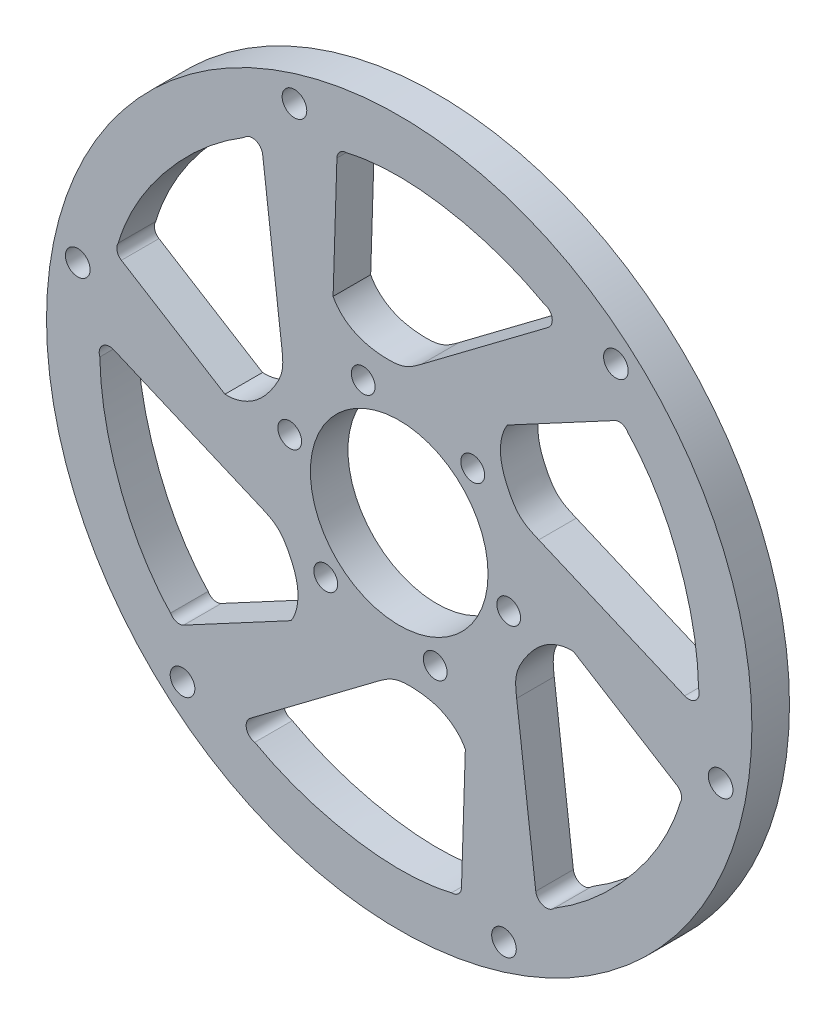
from build123d import *

# Parameters (mm, degrees)
SCHIZZO1_R                   = 37.92
SCHIZZO1_R_2                 = 1.325
SCHIZZO1_R_3                 = 9.55
SCHIZZO1_R_4                 = 1.28
ESTRUSIONE_ESTRUSIONE1_DEPTH = 4.04


with BuildPart() as part:
    # Schizzo1 → Estrusione-Estrusione1 (new body)
    with BuildSketch(Plane.XY):
        with Locations((39.644562935, 40.222708022)):
            Circle(SCHIZZO1_R)
        with Locations((28.381746106, 73.624975266)):
            Circle(SCHIZZO1_R_2, mode=Mode.SUBTRACT)
        with Locations((39.644562935, 40.222708022)):
            Circle(SCHIZZO1_R_3, mode=Mode.SUBTRACT)
        with Locations((35.774368233, 51.581475251)):
            Circle(SCHIZZO1_R_4, mode=Mode.SUBTRACT)
        with Locations((47.546446561, 49.253778566)):
            Circle(SCHIZZO1_R_4, mode=Mode.SUBTRACT)
        with Locations((62.940366498, 66.677727137)):
            Circle(SCHIZZO1_R_2, mode=Mode.SUBTRACT)
        with Locations((51.416641262, 37.895011337)):
            Circle(SCHIZZO1_R_4, mode=Mode.SUBTRACT)
        with Locations((74.203183328, 33.275459892)):
            Circle(SCHIZZO1_R_2, mode=Mode.SUBTRACT)
        with Locations((43.514757637, 28.863940793)):
            Circle(SCHIZZO1_R_4, mode=Mode.SUBTRACT)
        with Locations((50.907379765, 6.820440778)):
            Circle(SCHIZZO1_R_2, mode=Mode.SUBTRACT)
        with Locations((31.74267931, 31.191637478)):
            Circle(SCHIZZO1_R_4, mode=Mode.SUBTRACT)
        with Locations((16.348759372, 13.767688907)):
            Circle(SCHIZZO1_R_2, mode=Mode.SUBTRACT)
        with Locations((27.872484608, 42.550404707)):
            Circle(SCHIZZO1_R_4, mode=Mode.SUBTRACT)
        with Locations((5.085942543, 47.169956152)):
            Circle(SCHIZZO1_R_2, mode=Mode.SUBTRACT)
        with BuildLine():
            Line((32.537324842, 57.752341263), (32.947782143, 70.845929152))
            ThreePointArc((32.947782143, 70.845929152), (33.276613104, 71.574360929), (34.024210756, 71.856921375))
            add(Edge.make_bspline(
                [(34.024210756, 71.856921375), (37.813103061, 72.754463636), (45.237238781, 72.465064372), (52.177131888, 70.085413797), (55.180541117, 68.422554037)],
                knots=[0, 0, 0, 0, 0.531113686, 1, 1, 1, 1], degree=3))
            ThreePointArc((55.180541117, 68.422554037), (56.070695624, 67.573353666), (55.651210487, 66.416829331))
            Line((55.651210487, 66.416829331), (42.018531755, 56.173261728))
            add(Edge.make_bspline(
                [(32.537324842, 57.752341263), (33.085767208, 56.679660611), (34.829216379, 55.289156312), (37.666961886, 54.791954013), (40.192033726, 54.822389026), (41.396684563, 55.706006988), (42.018531755, 56.173261728)],
                knots=[0, 0, 0, 0, 0.332930463, 0.577052926, 0.800008074, 1, 1, 1, 1], degree=3))
        make_face(mode=Mode.SUBTRACT)
        with BuildLine():
            Line((54.645132059, 46.142067569), (70.332661194, 39.457605267))
            ThreePointArc((70.332661194, 39.457605267), (71.543983217, 39.67258265), (71.834335058, 40.868079251))
            add(Edge.make_bspline(
                [(64.230419238, 60.907182464), (66.902159789, 58.074676605), (70.363600535, 51.500486839), (71.772709238, 44.300537822), (71.834335058, 40.868079251)],
                knots=[0, 0, 0, 0, 0.531113686, 1, 1, 1, 1], degree=3))
            ThreePointArc((64.230419238, 60.907182464), (63.611915888, 61.413340799), (62.816659984, 61.333900877))
            Line((62.816659984, 61.333900877), (51.272051595, 55.142573382))
            add(Edge.make_bspline(
                [(51.272051595, 55.142573382), (50.617304082, 54.131268034), (50.284816621, 51.926144612), (51.273099553, 49.219983765), (52.561992967, 47.048424911), (53.929553988, 46.446975665), (54.645132059, 46.142067569)],
                knots=[0, 0, 0, 0, 0.332930463, 0.577052926, 0.800008074, 1, 1, 1, 1], degree=3))
        make_face(mode=Mode.SUBTRACT)
        with BuildLine():
            Line((52.271163239, 30.191513863), (54.326013642, 13.263483958))
            ThreePointArc((54.326013642, 13.263483958), (55.117850528, 12.321937006), (56.298356876, 12.668233236))
            add(Edge.make_bspline(
                [(69.850771418, 29.272969111), (68.733619663, 25.542920992), (64.770924689, 19.258130489), (59.240140286, 14.437832047), (56.298356876, 12.668233236)],
                knots=[0, 0, 0, 0, 0.531113686, 1, 1, 1, 1], degree=3))
            ThreePointArc((69.850771418, 29.272969111), (69.979865719, 30.061687892), (69.513440776, 30.710679746))
            Line((69.513440776, 30.710679746), (58.379289688, 37.61294014))
            add(Edge.make_bspline(
                [(58.379289688, 37.61294014), (57.176099809, 37.674315445), (55.100163177, 36.859696322), (53.250700602, 34.650737773), (52.014522176, 32.448743907), (52.177432361, 30.963676699), (52.271163239, 30.191513863)],
                knots=[0, 0, 0, 0, 0.332930463, 0.577052926, 0.800008074, 1, 1, 1, 1], degree=3))
        make_face(mode=Mode.SUBTRACT)
        with BuildLine():
            Line((37.270594115, 24.272154316), (23.637915383, 14.028586713))
            ThreePointArc((23.637915383, 14.028586713), (23.218430247, 12.872062378), (24.108584753, 12.022862007))
            add(Edge.make_bspline(
                [(45.264915115, 8.588494669), (41.476022809, 7.690952408), (34.051887089, 7.980351672), (27.111993983, 10.360002247), (24.108584753, 12.022862007)],
                knots=[0, 0, 0, 0, 0.531113686, 1, 1, 1, 1], degree=3))
            ThreePointArc((45.264915115, 8.588494669), (46.012512766, 8.871055115), (46.341343727, 9.599486892))
            Line((46.341343727, 9.599486892), (46.751801028, 22.693074781))
            add(Edge.make_bspline(
                [(46.751801028, 22.693074781), (46.203358662, 23.765755433), (44.459909491, 25.156259732), (41.622163984, 25.653462031), (39.097092144, 25.623027018), (37.892441308, 24.739409056), (37.270594115, 24.272154316)],
                knots=[0, 0, 0, 0, 0.332930463, 0.577052926, 0.800008074, 1, 1, 1, 1], degree=3))
        make_face(mode=Mode.SUBTRACT)
        with BuildLine():
            Line((24.643993811, 34.303348475), (8.956464676, 40.987810777))
            ThreePointArc((8.956464676, 40.987810777), (7.745142654, 40.772833394), (7.454790812, 39.577336793))
            add(Edge.make_bspline(
                [(15.058706632, 19.53823358), (12.386966081, 22.370739439), (8.925525335, 28.944929205), (7.516416632, 36.144878222), (7.454790812, 39.577336793)],
                knots=[0, 0, 0, 0, 0.531113686, 1, 1, 1, 1], degree=3))
            ThreePointArc((15.058706632, 19.53823358), (15.677209983, 19.032075245), (16.472465887, 19.111515167))
            Line((16.472465887, 19.111515167), (28.017074275, 25.302842662))
            add(Edge.make_bspline(
                [(28.017074275, 25.302842662), (28.671821788, 26.31414801), (29.004309249, 28.519271432), (28.016026317, 31.225432279), (26.727132903, 33.396991133), (25.359571882, 33.998440379), (24.643993811, 34.303348475)],
                knots=[0, 0, 0, 0, 0.332930463, 0.577052926, 0.800008074, 1, 1, 1, 1], degree=3))
        make_face(mode=Mode.SUBTRACT)
        with BuildLine():
            Line((27.017962631, 50.253902181), (24.963112228, 67.181932086))
            ThreePointArc((24.963112228, 67.181932086), (24.171275342, 68.123479038), (22.990768994, 67.777182808))
            add(Edge.make_bspline(
                [(9.438354453, 51.172446933), (10.555506207, 54.902495052), (14.518201181, 61.187285555), (20.048985584, 66.007583997), (22.990768994, 67.777182808)],
                knots=[0, 0, 0, 0, 0.531113686, 1, 1, 1, 1], degree=3))
            ThreePointArc((9.438354453, 51.172446933), (9.309260152, 50.383728152), (9.775685094, 49.734736298))
            Line((9.775685094, 49.734736298), (20.909836183, 42.832475904))
            add(Edge.make_bspline(
                [(20.909836183, 42.832475904), (22.113026061, 42.771100599), (24.188962693, 43.585719722), (26.038425268, 45.794678271), (27.274603694, 47.996672137), (27.11169351, 49.481739345), (27.017962631, 50.253902181)],
                knots=[0, 0, 0, 0, 0.332930463, 0.577052926, 0.800008074, 1, 1, 1, 1], degree=3))
        make_face(mode=Mode.SUBTRACT)
    extrude(amount=ESTRUSIONE_ESTRUSIONE1_DEPTH)


solid = part.part
